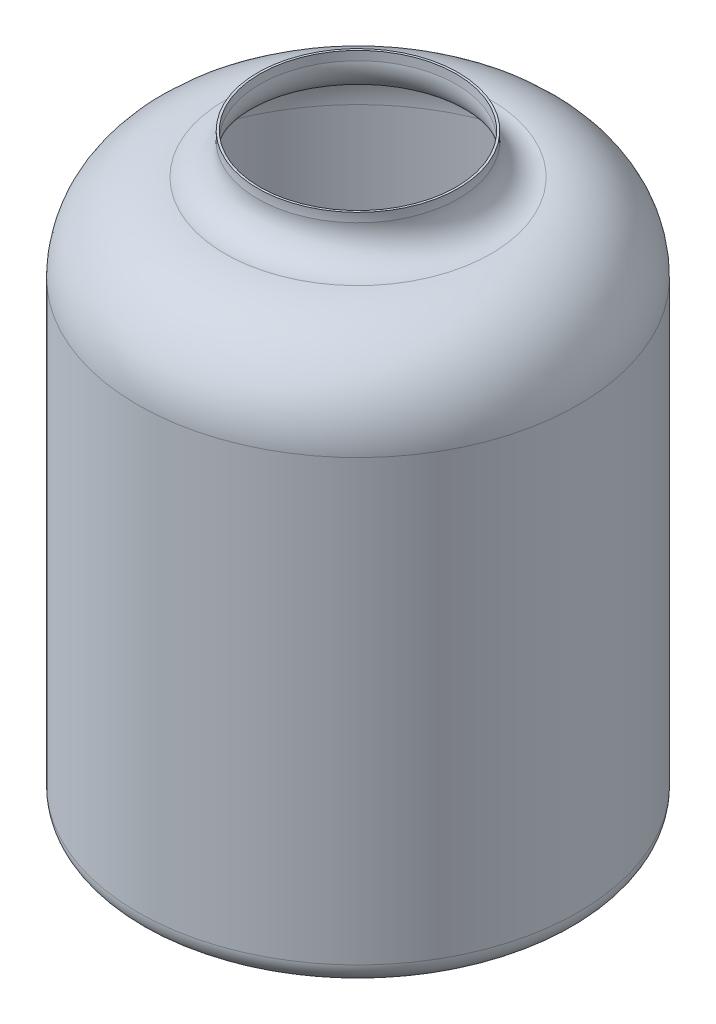
from build123d import *


with BuildPart() as part:
    # Sketch2 → Revolve1 (revolve)
    with BuildSketch(Plane.XY, mode=Mode.PRIVATE) as revolve1_sk:
        with BuildLine():
            Line((0, 0), (85.461855545, 0))
            Line((85.461855545, 0), (91, 0))
            ThreePointArc((91, 0), (98.071067812, 2.928932188), (101, 10))
            Line((101, 10), (101, 37.624801154))
            Line((101, 37.624801154), (101, 211.501152495))
            ThreePointArc((101, 211.501152495), (89.284271247, 239.785423743), (61, 251.501152495))
            ThreePointArc((61, 251.501152495), (50.215549394, 255.253431352), (46, 265.865364012))
            add(Edge.make_bspline(
                [(46, 270), (45.843669631, 267.80468678), (46, 265.865364012)],
                knots=[0, 0, 0, 0.134328339, 0.134328339, 0.134328339], degree=2))
            Line((46, 270), (45, 270))
            Line((45, 270), (45, 265.865364012))
            ThreePointArc((45, 265.865364012), (48.098109141, 255.05059881), (57.935996936, 249.59409898))
            Line((57.935996936, 249.59409898), (60, 249.59409898))
            ThreePointArc((60, 249.59409898), (88.284271247, 237.878370228), (100, 209.59409898))
            Line((100, 209.59409898), (100, 36.047532002))
            Line((100, 36.047532002), (100, 11))
            ThreePointArc((100, 11), (97.071067812, 3.928932188), (90, 1))
            Line((90, 1), (85.461855545, 1))
            Line((85.461855545, 1), (1, 1))
            Line((1, 1), (0, 1))
            Line((0, 1), (0, 0))
        make_face()
    revolve(revolve1_sk.sketch.rotate(Axis((0, 1, 0), (0, 1, 0)), 90), axis=Axis((0, 1, 0), (0, 1, 0)))


solid = part.part
